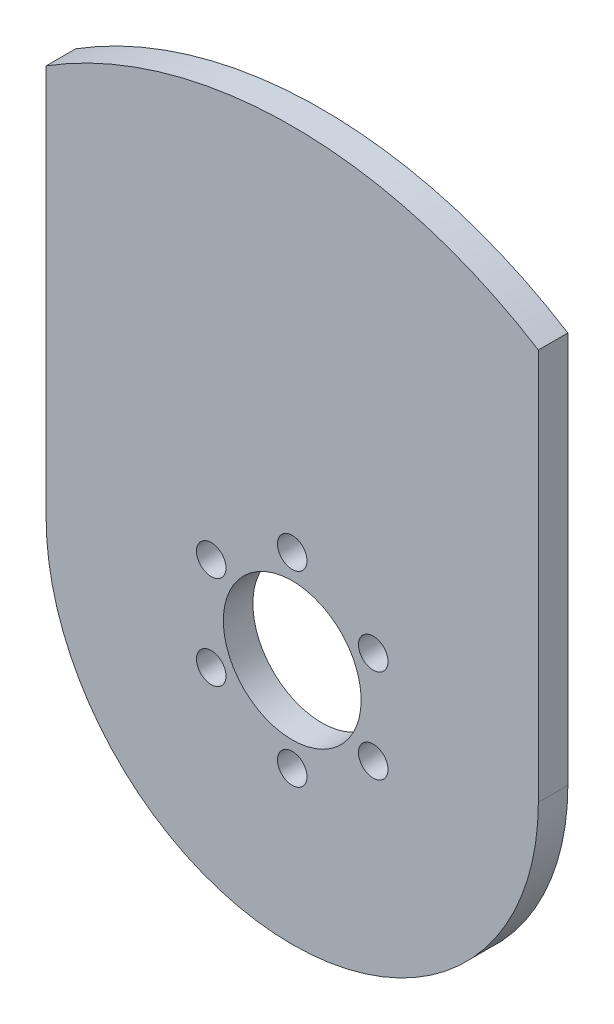
from build123d import *

# Parameters (mm, degrees)
ESQUISSE1_R             = 47
ESQUISSE1_R_2           = 7
BOSS_EXTRU_1_DEPTH      = 3
ESQUISSE2_R             = 1.5
ENL_V_MAT_EXTRU_1_DEPTH = 67.535704701


with BuildPart() as part:
    # Esquisse1 → Boss.-Extru.1 (new body)
    with BuildSketch(Plane.XY):
        Circle(ESQUISSE1_R)
        Circle(ESQUISSE1_R_2, mode=Mode.SUBTRACT)
    extrude(amount=BOSS_EXTRU_1_DEPTH)

    # Esquisse2 → Enlèv. mat.-Extru.1 (cut, through all)
    with BuildSketch(Plane.XY.offset(3)):
        with BuildLine():
            Line((25, 39.799497484), (25, 0))
            ThreePointArc((25, 0), (0, -25), (-25, 0))
            Line((-25, 0), (-25, 39.799497484))
            ThreePointArc((-25, 39.799497484), (0, -47), (25, 39.799497484))
        make_face()
        with Locations((0, 9.5)):
            Circle(ESQUISSE2_R)
        with Locations((8.227241336, 4.75)):
            Circle(ESQUISSE2_R)
        with Locations((8.227241336, -4.75)):
            Circle(ESQUISSE2_R)
        with Locations((0, -9.5)):
            Circle(ESQUISSE2_R)
        with Locations((-8.227241336, -4.75)):
            Circle(ESQUISSE2_R)
        with Locations((-8.227241336, 4.75)):
            Circle(ESQUISSE2_R)
    extrude(amount=-ENL_V_MAT_EXTRU_1_DEPTH, mode=Mode.SUBTRACT)


solid = part.part
